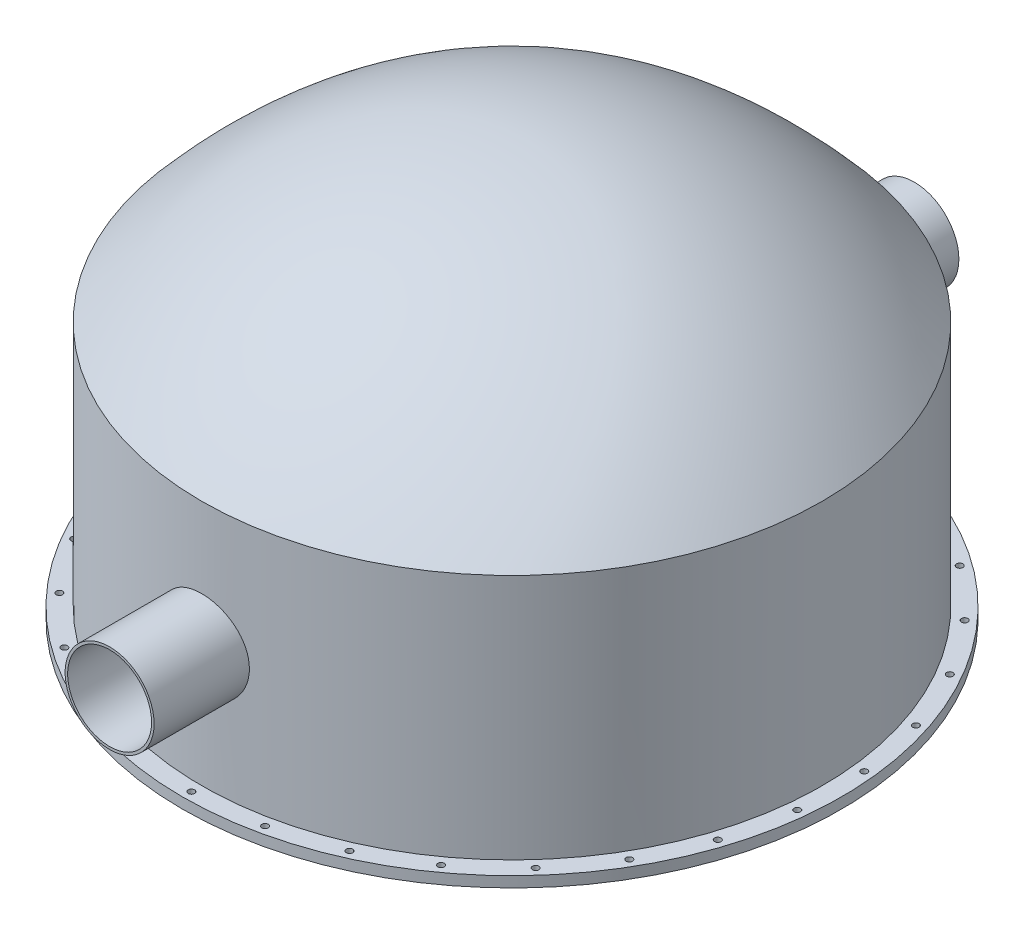
from build123d import *

# Parameters (mm, degrees)
BOSS_EXTRUDE1_REACH      = 5771.838
BOSS_EXTRUDE1_END_RADIUS = 2126.02
SKETCH3_R                = 304.8
SKETCH4_R                = 287.4
CUT_EXTRUDE1_DEPTH       = 6209.446254571
SKETCH5_R                = 22
CUT_EXTRUDE2_DEPTH       = 73


with BuildPart() as part:
    # Sketch1 → Revolve1 (revolve)
    with BuildSketch(Plane(origin=(0, 0, 0), x_dir=(0, 0, -1), z_dir=(1, 0, 0)), mode=Mode.PRIVATE) as revolve1_sk:
        with BuildLine():
            Line((-2081.13, 0), (-2081.13, -1744.12))
            Line((-2081.13, -1744.12), (-2258.02, -1744.12))
            Line((-2258.02, -1744.12), (-2258.02, -1671.12))
            Line((-2258.02, -1671.12), (-2126.02, -1671.12))
            Line((-2126.02, -1671.12), (-2126.02, 16.908694058))
            add(Edge.make_bspline(
                [(0, 1089.3), (-223.462111711, 1089.311057215), (-581.422471541, 1026.211890554), (-859.810917531, 942.072223216), (-1130.019387147, 824.365036373), (-1391.8991989, 673.235294536), (-1613.69332384, 511.89661327), (-1768.176969901, 381.130401339), (-1874.480833736, 282.364998713), (-1949.431957446, 207.95119084), (-2001.441268917, 154.058336721), (-2038.346667779, 114.5979888), (-2064.066656222, 86.525362358), (-2082.377199325, 66.232230793), (-2095.16609191, 51.91461534), (-2104.286077598, 41.627045393), (-2110.661880175, 34.399277298), (-2115.215669271, 29.216268924), (-2121.510582718, 22.044882998), (-2126.02, 16.908694058)],
                knots=[0, 0, 0, 0.188640612, 0.31440102, 0.440161428, 0.565921836, 0.691682244, 0.78600255, 0.848882754, 0.896042907, 0.927483009, 0.951063086, 0.966783137, 0.978573175, 0.9864332, 0.99232822, 0.996258232, 0.999205742, 1.001170748, 1.006083264, 1.006083264, 1.006083264], degree=2))
            Line((0, 1089.3), (0, 1044.41))
            add(Edge.make_bspline(
                [(0, 1044.41), (-1164.248075476, 1044.41), (-2081.13, 0)],
                knots=[0, 0, 0, 1, 1, 1], degree=2))
        make_face()
    revolve(revolve1_sk.sketch.rotate(Axis((0, 0, 0), (0, 1, 0)), 180), axis=Axis((0, 0, 0), (0, 1, 0)))

    # Boss-Extrude1: up to this cylinder (the profile starts outside it)
    boss_extrude1_end = Plane(origin=(0, -835.62, 0), z_dir=(0, -1, 0)) * Cylinder(BOSS_EXTRUDE1_END_RADIUS, 15796.716, mode=Mode.PRIVATE)
    # Sketch3 → Boss-Extrude1 (add, up to the surface)
    with BuildSketch(Plane.XY.offset(2757), mode=Mode.PRIVATE) as boss_extrude1_sk1:
        with Locations((0, -835.62)):
            Circle(SKETCH3_R)
    boss_extrude1_tool1 = extrude(boss_extrude1_sk1.sketch, amount=-BOSS_EXTRUDE1_REACH, mode=Mode.PRIVATE) - boss_extrude1_end
    boss_extrude1 = boss_extrude1_tool1.solids().sort_by_distance((0, -835.62, 2757))[0]
    add(boss_extrude1)

    # Mirror1: Boss-Extrude1 across plane
    add(boss_extrude1.mirror(Plane.XY))

    # Sketch4 → Cut-Extrude1 (cut, through all)
    with BuildSketch(Plane.XY.offset(2757)):
        with Locations((0, -835.62)):
            Circle(SKETCH4_R)
    extrude(amount=-CUT_EXTRUDE1_DEPTH, mode=Mode.SUBTRACT)

    # Sketch5 → Cut-Extrude2 (cut)
    with BuildSketch(Plane.XZ.offset(1744.12)):
        with Locations(Location((0, 2196.0235, 0), (0, 0, 270))):
            Circle(SKETCH5_R)
        with Locations(Location((456.578958961, 2148.03511768, 0), (0, 0, 270))):
            Circle(SKETCH5_R)
        with Locations(Location((893.203226506, 2006.167293301, 0), (0, 0, 270))):
            Circle(SKETCH5_R)
        with Locations(Location((1290.790226988, 1776.620331547, 0), (0, 0, 270))):
            Circle(SKETCH5_R)
        with Locations(Location((1631.963500652, 1469.426536133, 0), (0, 0, 270))):
            Circle(SKETCH5_R)
        with Locations(Location((1901.812138308, 1098.01175, 0), (0, 0, 270))):
            Circle(SKETCH5_R)
        with Locations(Location((2088.542459612, 678.608581547, 0), (0, 0, 270))):
            Circle(SKETCH5_R)
        with Locations(Location((2183.993453493, 229.546961755, 0), (0, 0, 270))):
            Circle(SKETCH5_R)
        with Locations(Location((2183.993453493, -229.546961755, 0), (0, 0, 270))):
            Circle(SKETCH5_R)
        with Locations(Location((2088.542459612, -678.608581547, 0), (0, 0, 270))):
            Circle(SKETCH5_R)
        with Locations(Location((1901.812138308, -1098.01175, 0), (0, 0, 270))):
            Circle(SKETCH5_R)
        with Locations(Location((1631.963500652, -1469.426536133, 0), (0, 0, 270))):
            Circle(SKETCH5_R)
        with Locations(Location((1290.790226988, -1776.620331547, 0), (0, 0, 270))):
            Circle(SKETCH5_R)
        with Locations(Location((893.203226506, -2006.167293301, 0), (0, 0, 270))):
            Circle(SKETCH5_R)
        with Locations(Location((456.578958961, -2148.03511768, 0), (0, 0, 270))):
            Circle(SKETCH5_R)
        with Locations(Location((0, -2196.0235, 0), (0, 0, 270))):
            Circle(SKETCH5_R)
        with Locations(Location((-456.57895896, -2148.03511768, 0), (0, 0, 270))):
            Circle(SKETCH5_R)
        with Locations(Location((-893.203226505, -2006.167293301, 0), (0, 0, 270))):
            Circle(SKETCH5_R)
        with Locations(Location((-1290.790226988, -1776.620331547, 0), (0, 0, 270))):
            Circle(SKETCH5_R)
        with Locations(Location((-1631.963500652, -1469.426536133, 0), (0, 0, 270))):
            Circle(SKETCH5_R)
        with Locations(Location((-1901.812138307, -1098.01175, 0), (0, 0, 270))):
            Circle(SKETCH5_R)
        with Locations(Location((-2088.542459612, -678.608581547, 0), (0, 0, 270))):
            Circle(SKETCH5_R)
        with Locations(Location((-2183.993453493, -229.546961755, 0), (0, 0, 270))):
            Circle(SKETCH5_R)
        with Locations(Location((-2183.993453493, 229.546961755, 0), (0, 0, 270))):
            Circle(SKETCH5_R)
        with Locations(Location((-2088.542459612, 678.608581547, 0), (0, 0, 270))):
            Circle(SKETCH5_R)
        with Locations(Location((-1901.812138308, 1098.01175, 0), (0, 0, 270))):
            Circle(SKETCH5_R)
        with Locations(Location((-1631.963500652, 1469.426536133, 0), (0, 0, 270))):
            Circle(SKETCH5_R)
        with Locations(Location((-1290.790226988, 1776.620331547, 0), (0, 0, 270))):
            Circle(SKETCH5_R)
        with Locations(Location((-893.203226506, 2006.167293301, 0), (0, 0, 270))):
            Circle(SKETCH5_R)
        with Locations(Location((-456.578958961, 2148.03511768, 0), (0, 0, 270))):
            Circle(SKETCH5_R)
    extrude(amount=-CUT_EXTRUDE2_DEPTH, mode=Mode.SUBTRACT)


solid = part.part
